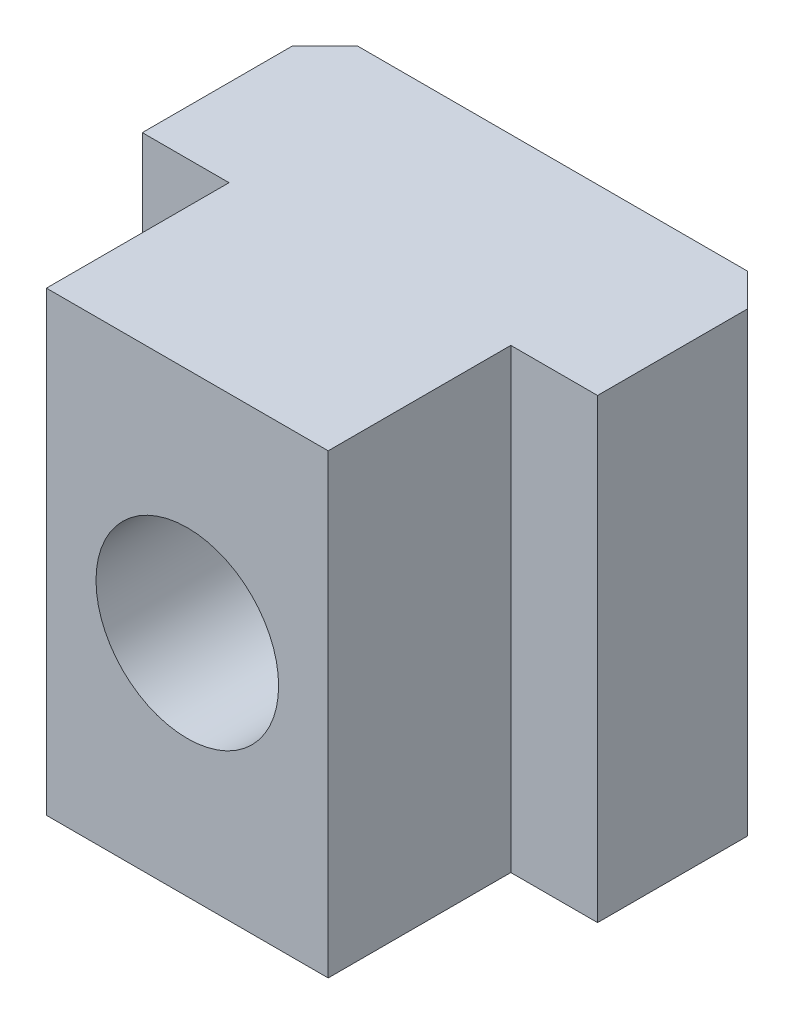
from build123d import *

# Parameters (mm, degrees)
BOSS_EXTRUDE1_DEPTH = 17.5
M16_TAPPED_HOLE1_D  = 14


with BuildPart() as part:
    # Sketch1 → Boss-Extrude1 (new, symmetric)
    with BuildSketch(Plane(origin=(0, 0, 0), x_dir=(1, 0, 0), z_dir=(0, 1, 0))):
        Polygon((-10.8, 0), (-17.45, 0), (-17.45, 11.5), (-14.95, 14), (14.95, 14), (17.45, 11.5), (17.45, 0), (10.8, 0), (10.8, -14), (-10.8, -14), align=None)
    extrude(amount=BOSS_EXTRUDE1_DEPTH, both=True)

    # M16 Tapped Hole1 (through all)
    with Locations(Plane.XY.offset(14)):
        with Locations((0, 0)):
            Hole(M16_TAPPED_HOLE1_D / 2)


solid = part.part
